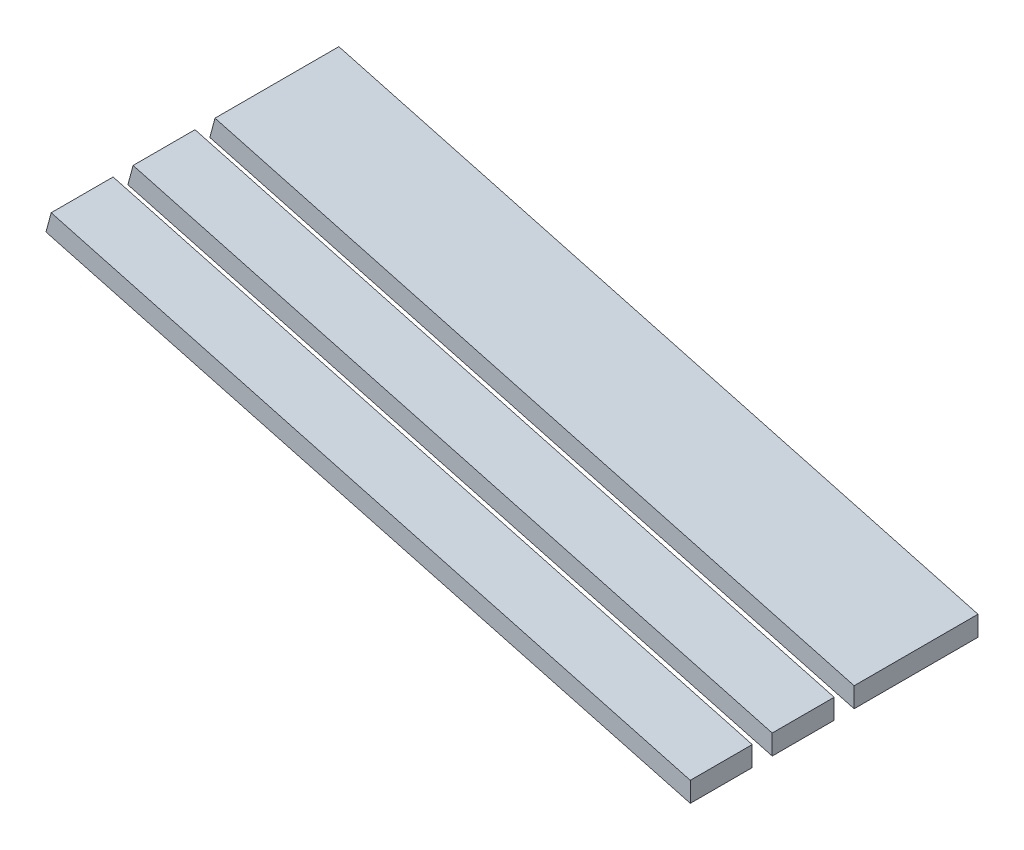
from build123d import *

# Parameters (mm, degrees)
SKETCH1_W                = 4300
SKETCH1_H                = 620
BOSS_EXTRUDE1_DEPTH      = 100
SKETCH1_H_2              = 310
BOSS_EXTRUDE1_2_DEPTH    = 100
BOSS_EXTRUDE1_3_DEPTH    = 100
BOSS_EXTRUDE2_DEPTH      = 565
BOSS_EXTRUDE2_DEPTH_BACK = 875
CUT_EXTRUDE1_DEPTH       = 5514.356867062
CUT_EXTRUDE1_DEPTH_BACK  = 5514.356867062
SKETCH3_W                = 3725
SKETCH3_H                = 100
BOSS_EXTRUDE3_REACH      = 5531.851
SKETCH4_W                = 100
SKETCH4_H                = 310
SKETCH4_H_2              = 620
SKETCH5_W                = 4300
SKETCH5_H                = 1440
CUT_EXTRUDE2_DEPTH       = 1771


with BuildPart() as part:
    # Sketch1 → Boss-Extrude1 (new body)
    with BuildSketch(Plane(origin=(0, 0, 0), x_dir=(1, 0, 0), z_dir=(0, 1, 0))):
        with Locations((0, 565)):
            Rectangle(SKETCH1_W, SKETCH1_H)
    extrude(amount=BOSS_EXTRUDE1_DEPTH)



with BuildPart() as body_2:
    # Sketch1 → Boss-Extrude1 2 (new body)
    with BuildSketch(Plane(origin=(0, 0, 0), x_dir=(1, 0, 0), z_dir=(0, 1, 0))):
        Rectangle(SKETCH1_W, SKETCH1_H_2)
    extrude(amount=BOSS_EXTRUDE1_2_DEPTH)


with BuildPart() as body_3:
    # Sketch1 → Boss-Extrude1 3 (new body)
    with BuildSketch(Plane(origin=(0, 0, 0), x_dir=(1, 0, 0), z_dir=(0, 1, 0))):
        with Locations((0, -410)):
            Rectangle(SKETCH1_W, SKETCH1_H_2)
    extrude(amount=BOSS_EXTRUDE1_3_DEPTH)


with BuildPart() as part_1:
    add(part.part)

    add(body_2.part)  # Boss-Extrude2 merges body 2

    add(body_3.part)  # Boss-Extrude2 merges body 3
    # Sketch2 → Boss-Extrude2 (add, two sides: drawn at the far end of the back side and taken through both)
    with BuildSketch(Plane.XY.offset(-BOSS_EXTRUDE2_DEPTH_BACK)):
        Polygon((-2150, 100), (-5349.11809549, 960.728728219), (-5375, 864.13614559), (-2150, 0), align=None)
    extrude(amount=BOSS_EXTRUDE2_DEPTH + BOSS_EXTRUDE2_DEPTH_BACK)

    # Sketch3 → Cut-Extrude1 (cut, two sides: drawn at the far end of the back side and taken through both)
    with BuildSketch(Plane(origin=(0, 100, 0), x_dir=(1, 0, 0), z_dir=(0, 1, 0)).offset(-CUT_EXTRUDE1_DEPTH_BACK)):
        with Locations((-4012.5, 205)):
            Rectangle(SKETCH3_W, SKETCH3_H)
        with Locations((-4012.5, -205)):
            Rectangle(SKETCH3_W, SKETCH3_H)
    extrude(amount=CUT_EXTRUDE1_DEPTH + CUT_EXTRUDE1_DEPTH_BACK, mode=Mode.SUBTRACT)


with BuildPart() as cut_extrude1_piece_1:
    # of the separate pieces the step leaves, piece 1, a body of its own (cut_extrude1_pieces)
    add(part_1.part.solids().sort_by_distance((2150, 0, -875))[0])



with BuildPart() as cut_extrude1_piece_2:
    # of the separate pieces the step leaves, piece 2, a body of its own (cut_extrude1_pieces)
    add(part_1.part.solids().sort_by_distance((-5375, 864.13614559, -155))[0])


with BuildPart() as cut_extrude1_piece_3:
    # of the separate pieces the step leaves, piece 3, a body of its own (cut_extrude1_pieces)
    add(part_1.part.solids().sort_by_distance((-5375, 864.13614559, 255))[0])


with BuildPart() as cut_extrude1_piece_1_1:
    add(cut_extrude1_piece_1.part)

    add(cut_extrude1_piece_2.part)  # Boss-Extrude3 merges Cut-Extrude1 piece 2

    add(cut_extrude1_piece_3.part)  # Boss-Extrude3 merges Cut-Extrude1 piece 3
    # Boss-Extrude3: up to this plane
    boss_extrude3_end = Plane(origin=(-3266.534841529, -342.939503471, -3125), z_dir=(0.003352354687718555, 0.9999943808432364, 0))
    # Sketch4 → Boss-Extrude3 (add, up to the surface)
    with BuildSketch(Plane.XZ, mode=Mode.PRIVATE) as boss_extrude3_sk1:
        with Locations((-2100, 410)):
            Rectangle(SKETCH4_W, SKETCH4_H)
    boss_extrude3_tool1 = split(extrude(boss_extrude3_sk1.sketch, amount=BOSS_EXTRUDE3_REACH, mode=Mode.PRIVATE), bisect_by=boss_extrude3_end, keep=Keep.BOTH, mode=Mode.PRIVATE)
    add(boss_extrude3_tool1.solids().sort_by_distance((-2100, 0, 410))[0])
    # Sketch4 → Boss-Extrude3 (add, up to the surface)
    with BuildSketch(Plane.XZ, mode=Mode.PRIVATE) as boss_extrude3_sk2:
        with Locations((-2100, 0)):
            Rectangle(SKETCH4_W, SKETCH4_H)
    boss_extrude3_tool2 = split(extrude(boss_extrude3_sk2.sketch, amount=BOSS_EXTRUDE3_REACH, mode=Mode.PRIVATE), bisect_by=boss_extrude3_end, keep=Keep.BOTH, mode=Mode.PRIVATE)
    add(boss_extrude3_tool2.solids().sort_by_distance((-2100, 0, 0))[0])
    # Sketch4 → Boss-Extrude3 (add, up to the surface)
    with BuildSketch(Plane.XZ, mode=Mode.PRIVATE) as boss_extrude3_sk3:
        with Locations((-2100, -565)):
            Rectangle(SKETCH4_W, SKETCH4_H_2)
    boss_extrude3_tool3 = split(extrude(boss_extrude3_sk3.sketch, amount=BOSS_EXTRUDE3_REACH, mode=Mode.PRIVATE), bisect_by=boss_extrude3_end, keep=Keep.BOTH, mode=Mode.PRIVATE)
    add(boss_extrude3_tool3.solids().sort_by_distance((-2100, 0, -565))[0])
    # Sketch4 → Boss-Extrude3 (add, up to the surface)
    with BuildSketch(Plane.XZ, mode=Mode.PRIVATE) as boss_extrude3_sk4:
        with Locations((2100, 410)):
            Rectangle(SKETCH4_W, SKETCH4_H)
    boss_extrude3_tool4 = split(extrude(boss_extrude3_sk4.sketch, amount=BOSS_EXTRUDE3_REACH, mode=Mode.PRIVATE), bisect_by=boss_extrude3_end, keep=Keep.BOTH, mode=Mode.PRIVATE)
    add(boss_extrude3_tool4.solids().sort_by_distance((2100, 0, 410))[0])
    # Sketch4 → Boss-Extrude3 (add, up to the surface)
    with BuildSketch(Plane.XZ, mode=Mode.PRIVATE) as boss_extrude3_sk5:
        with Locations((2100, 0)):
            Rectangle(SKETCH4_W, SKETCH4_H)
    boss_extrude3_tool5 = split(extrude(boss_extrude3_sk5.sketch, amount=BOSS_EXTRUDE3_REACH, mode=Mode.PRIVATE), bisect_by=boss_extrude3_end, keep=Keep.BOTH, mode=Mode.PRIVATE)
    add(boss_extrude3_tool5.solids().sort_by_distance((2100, 0, 0))[0])
    # Sketch4 → Boss-Extrude3 (add, up to the surface)
    with BuildSketch(Plane.XZ, mode=Mode.PRIVATE) as boss_extrude3_sk6:
        with Locations((2100, -565)):
            Rectangle(SKETCH4_W, SKETCH4_H_2)
    boss_extrude3_tool6 = split(extrude(boss_extrude3_sk6.sketch, amount=BOSS_EXTRUDE3_REACH, mode=Mode.PRIVATE), bisect_by=boss_extrude3_end, keep=Keep.BOTH, mode=Mode.PRIVATE)
    add(boss_extrude3_tool6.solids().sort_by_distance((2100, 0, -565))[0])

    # Sketch5 → Cut-Extrude2 (cut)
    with BuildSketch(Plane(origin=(0, 100, 0), x_dir=(1, 0, 0), z_dir=(0, 1, 0))):
        with Locations((0, 155)):
            Rectangle(SKETCH5_W, SKETCH5_H)
    extrude(amount=-CUT_EXTRUDE2_DEPTH, mode=Mode.SUBTRACT)


solid = cut_extrude1_piece_1_1.part
